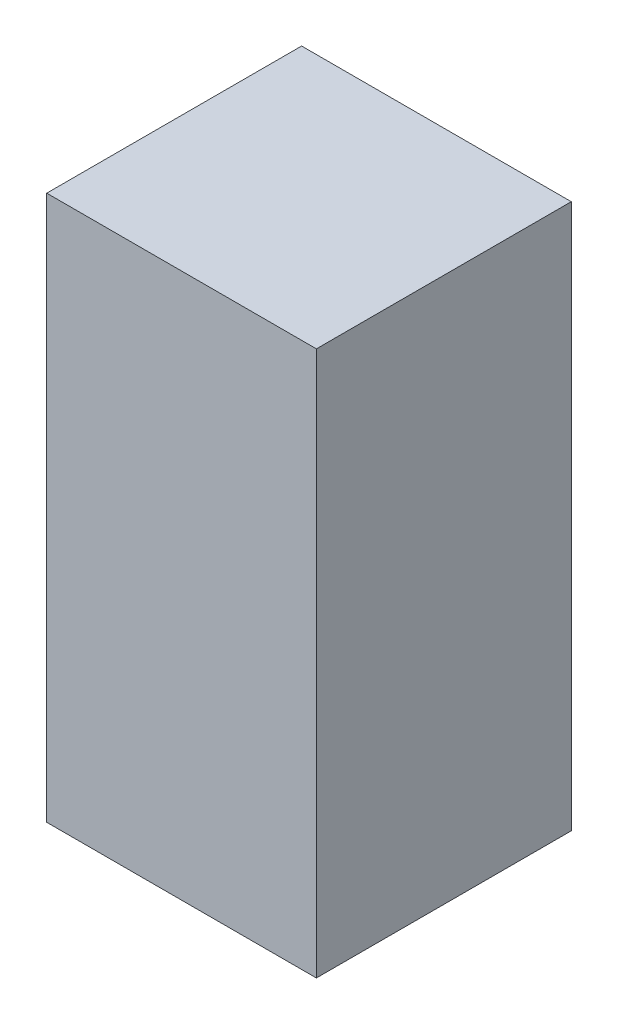
from build123d import *

# Parameters (mm, degrees)
SKETCH1_W           = 37.084
SKETCH1_H           = 35.052
BOSS_EXTRUDE1_DEPTH = 74.93


with BuildPart() as part:
    # Sketch1 → Boss-Extrude1 (new body)
    with BuildSketch(Plane(origin=(0, 0, 0), x_dir=(1, 0, 0), z_dir=(0, 1, 0))):
        with Locations((18.542, 17.526)):
            Rectangle(SKETCH1_W, SKETCH1_H)
    extrude(amount=BOSS_EXTRUDE1_DEPTH)


solid = part.part
